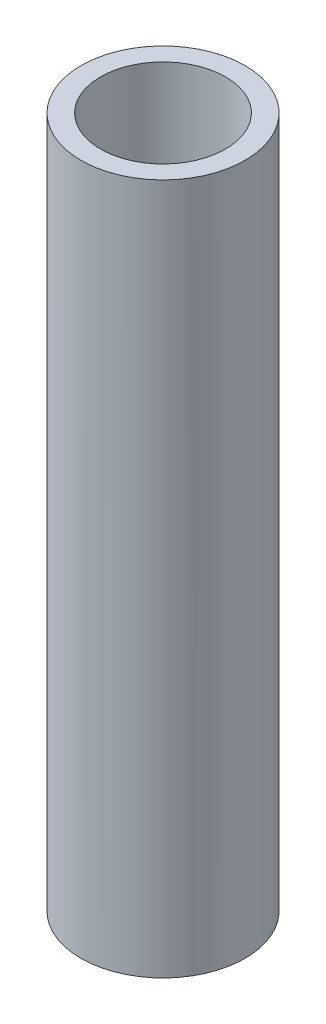
from build123d import *

# Parameters (mm, degrees)
SKETCH1_R           = 1.05
SKETCH1_R_2         = 0.8
BOSS_EXTRUDE1_DEPTH = 8.841037076


with BuildPart() as part:
    # Sketch1 → Boss-Extrude1 (new body)
    with BuildSketch(Plane(origin=(0, 0, 0), x_dir=(1, 0, 0), z_dir=(0, 1, 0))):
        with Locations(Location((0, 0, 0), (0, 0, 90))):
            Circle(SKETCH1_R)
        with Locations(Location((0, 0, 0), (0, 0, 90))):
            Circle(SKETCH1_R_2, mode=Mode.SUBTRACT)
    extrude(amount=BOSS_EXTRUDE1_DEPTH)


solid = part.part
